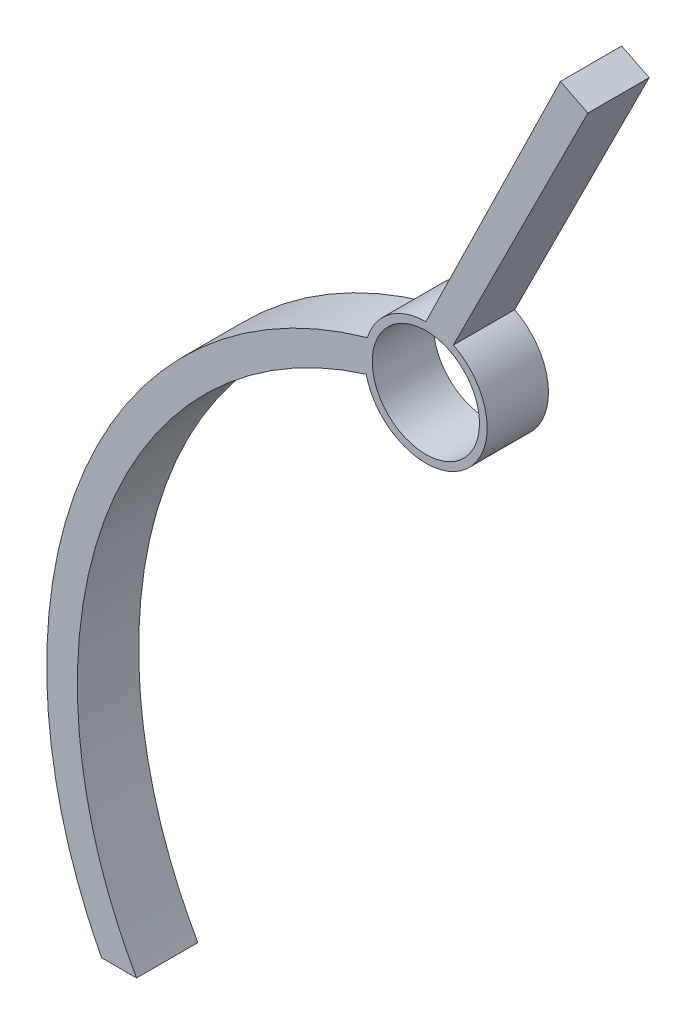
from build123d import *

# Parameters (mm, degrees)
CROQUIS1_R               = 35
SALIENTE_EXTRUIR15_DEPTH = 40


with BuildPart() as part:
    # Croquis1 → Saliente-Extruir15 (new body)
    with BuildSketch(Plane.XY):
        with BuildLine():
            Line((-14.686304328, 314.09938136), (73.062849976, 489.074174319))
            Line((73.062849976, 489.074174319), (55.185016864, 498.039835657))
            Line((55.185016864, 498.039835657), (-32.617627004, 318.343715137))
            ThreePointArc((-32.617627004, 318.343715137), (-56.321599928, 310.563610662), (-70.80460356, 290.249798518))
            add(Edge.make_bspline(
                [(-70.80460356, 290.249798518), (-421.705541448, 191.98441708), (-244.154369287, -146.862508424)],
                knots=[3.397241876, 3.397241876, 3.397241876, 5.223953064, 5.223953064, 5.223953064], degree=2, weights=[1, 0.611093045, 1]))
            Line((-244.154369287, -146.862508424), (-221.365281412, -146.862508424))
            add(Edge.make_bspline(
                [(-71.555520961, 269.187274007), (-401.226138708, 167.553458018), (-221.365281412, -146.862508424)],
                knots=[0.278811815, 0.278811815, 0.278811815, 2.122934595, 2.122934595, 2.122934595], degree=2, weights=[1, 0.604178825, 1]))
            ThreePointArc((-71.555520961, 269.187274007), (-7.826633559, 246.952527775), (-14.686304328, 314.09938136))
        make_face()
        with Locations((-32.617627004, 278.343715137)):
            Circle(CROQUIS1_R, mode=Mode.SUBTRACT)
    extrude(amount=SALIENTE_EXTRUIR15_DEPTH)


solid = part.part
